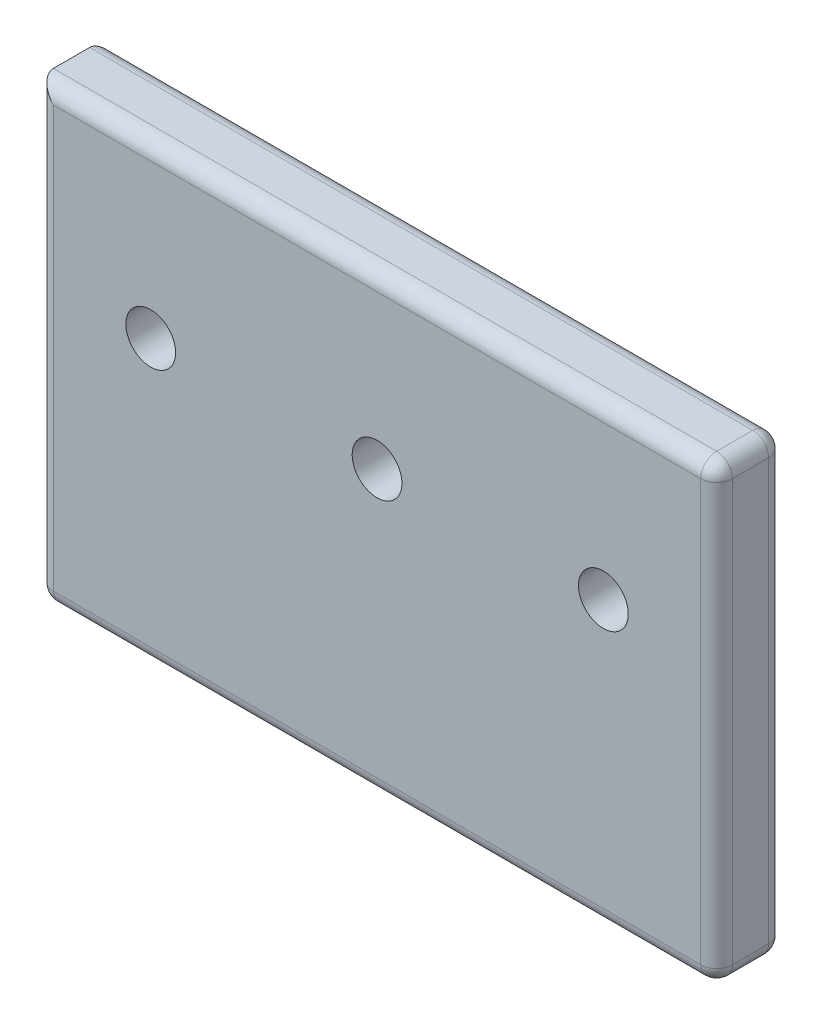
from build123d import *

# Parameters (mm, degrees)
SKETCH_1_W              = 16
SKETCH_1_H              = 3
EXTRUDE_1_DEPTH         = 10
SKETCH_2_W              = 30
SKETCH_2_H              = 20
EXTRUDE_2_DEPTH         = 3
HOLE_WIZARD_2_2_2_2_1_D = 2.2
FILLET_1_R              = 0.7
HOLE_WIZARD_2_2_2_2_2_D = 2.2


with BuildPart() as part:
    # 草图1 → 凸台-拉伸1 (new body)
    with BuildSketch(Plane.XY):
        with Locations((0, 1.5)):
            Rectangle(SKETCH_1_W, SKETCH_1_H)
    extrude(amount=-EXTRUDE_1_DEPTH)

    # 草图2 → 凸台-拉伸2 (add)
    with BuildSketch(Plane.XY):
        with Locations((7, 10)):
            Rectangle(SKETCH_2_W, SKETCH_2_H)
    extrude(amount=EXTRUDE_2_DEPTH)

    # Ø2.2 (2.2) 直径孔1 (through all)
    with Locations(Plane(origin=(0, 3, 0), x_dir=(1, 0, 0), z_dir=(0, 1, 0))):
        with Locations((-5, 5), (5, 5)):
            Hole(HOLE_WIZARD_2_2_2_2_1_D / 2)

    # 圆角1
    fillet_1_edges = [part.edges().sort_by_distance(p)[0] for p in [
        (8, 1.5, -10),
        (-8, 11.5, 0),
        (15, 0, 0),
        (22, 10, 0),
        (22, 0, 1.5),
        (7, 20, 0),
        (22, 20, 1.5),
        (-8, 10, 3),
        (7, 0, 3),
        (0, 3, -10),
        (22, 10, 3),
        (7, 20, 3),
        (-8, 1.5, -10),
        (0, 3, 0),
        (8, 1.5, 0),
        (-8, 3, -5),
        (8, 3, -5),
        (8, 0, -5),
        (-8, 0, -3.5),
        (0, 0, -10),
    ]]
    fillet(fillet_1_edges, radius=FILLET_1_R)

    # Ø2.2 (2.2) 直径孔2 (through all)
    with Locations(Plane(origin=(0, 0, 0), x_dir=(-1, 0, 0), z_dir=(0, 0, -1))):
        with Locations((-17, 12.52), (-7, 12.52), (3, 12.52)):
            Hole(HOLE_WIZARD_2_2_2_2_2_D / 2)


solid = part.part
